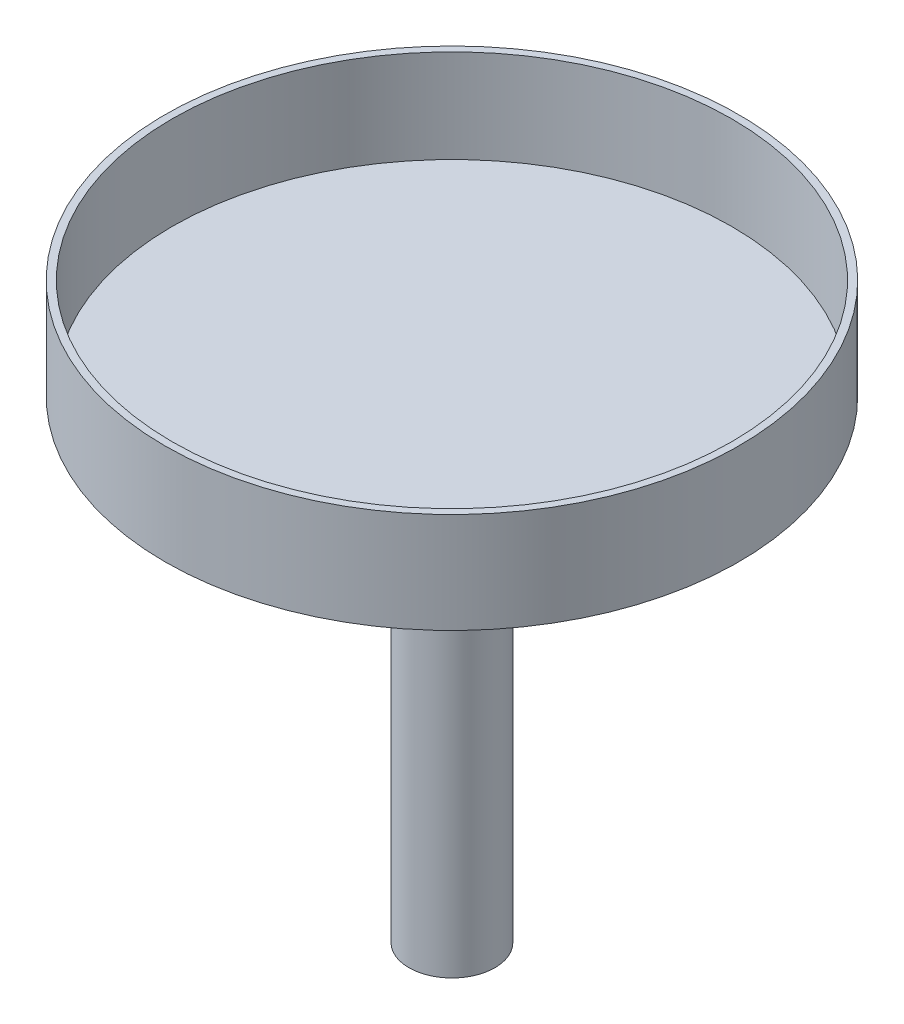
from build123d import *


with BuildPart() as part:
    # Sketch2 → Revolve1 (revolve)
    with BuildSketch(Plane.XY, mode=Mode.PRIVATE) as revolve1_sk:
        Polygon((30, -330), (30, 0), (200, 0), (200, 70), (195, 70), (195, 5), (0, 5), (0, -330), align=None)
    revolve(revolve1_sk.sketch.rotate(Axis((0, 34.772727273, 0), (0, -1, 0)), 90), axis=Axis((0, 34.772727273, 0), (0, -1, 0)))


solid = part.part
